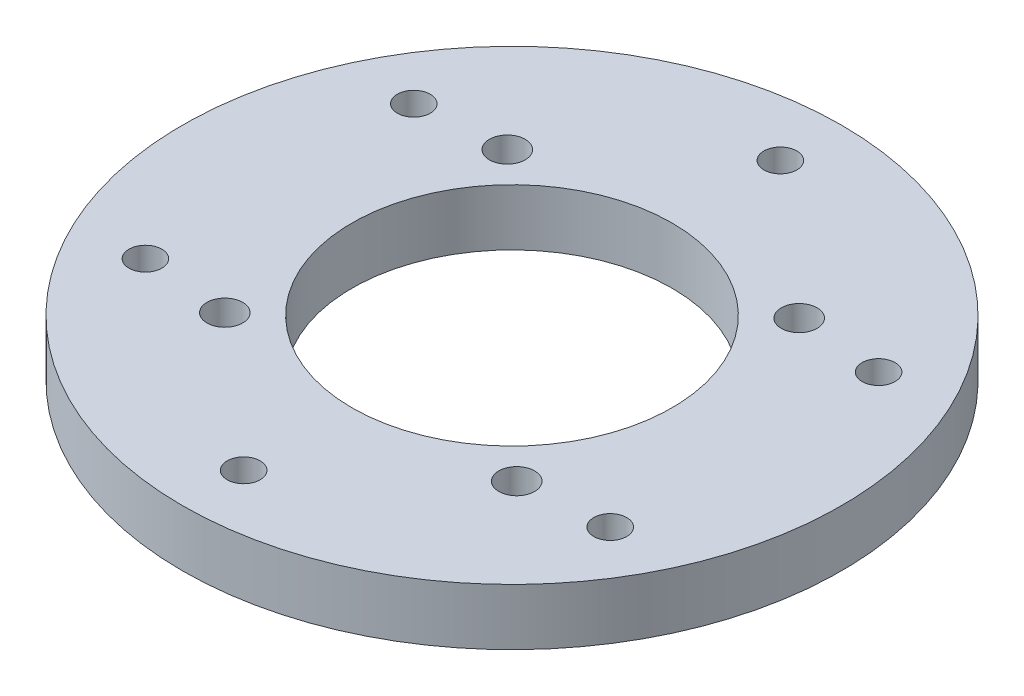
from build123d import *

# Parameters (mm, degrees)
SKETCH_1_R               = 35
EXTRUDE_1_DEPTH          = 6
HOLE_WIZARD_1_D          = 3.5
PATTERN_CIRCULAR_1_COUNT = 6
HOLE_WIZARD_2_D          = 3.8
SKETCH_8_R               = 11
CUT_EXTRUDE_1_DEPTH      = 10
HOLE_WIZARD_3_D          = 7
HOLE_WIZARD_3_DEPTH      = 1.5
SKETCH_13_R              = 17
CUT_EXTRUDE_2_DEPTH      = 10


with BuildPart() as part:
    # 草图1 → 凸台-拉伸1 (new body)
    with BuildSketch(Plane(origin=(0, 0, 0), x_dir=(1, 0, 0), z_dir=(0, 1, 0))):
        with Locations(Location((0, 0, 0), (0, 0, 270))):
            Circle(SKETCH_1_R)
    extrude(amount=EXTRUDE_1_DEPTH)

    # 孔1 (through all)
    with Locations(Plane(origin=(0, 6, 0), x_dir=(1, 0, 0), z_dir=(0, 1, 0))):
        with Locations((0, 28.5)):
            hole_wizard_1 = Hole(HOLE_WIZARD_1_D / 2)

    # 阵列(圆周)1: 孔1 ×6 about axis
    pattern_circular_1_axis = Axis((0, 0, 0), (0, 1, 0))
    for i in range(1, PATTERN_CIRCULAR_1_COUNT):
        add(hole_wizard_1.rotate(pattern_circular_1_axis, i * 360 / PATTERN_CIRCULAR_1_COUNT), mode=Mode.SUBTRACT)

    # 孔2 (through all)
    with Locations(Plane(origin=(0, 6, 0), x_dir=(1, 0, 0), z_dir=(0, 1, 0))):
        with Locations((-15.5, 15), (15.5, 15), (15.5, -15), (-15.5, -15)):
            Hole(HOLE_WIZARD_2_D / 2)

    # 草图8 → 切除-拉伸1 (cut)
    with BuildSketch(Plane(origin=(0, 6, 0), x_dir=(1, 0, 0), z_dir=(0, 1, 0))):
        with Locations(Location((0, 0, 0), (0, 0, 270))):
            Circle(SKETCH_8_R)
    extrude(amount=-CUT_EXTRUDE_1_DEPTH, mode=Mode.SUBTRACT)

    # 孔3
    with Locations(Plane(origin=(0, 0, 0), x_dir=(-1, 0, 0), z_dir=(0, -1, 0))):
        with Locations((-15.5, 15), (15.5, 15), (15.5, -15), (-15.5, -15)):
            Hole(HOLE_WIZARD_3_D / 2, depth=HOLE_WIZARD_3_DEPTH)

    # 草图13 → 切除-拉伸2 (cut)
    with BuildSketch(Plane.XZ):
        with Locations(Location((0, 0, 0), (0, 0, 270))):
            Circle(SKETCH_13_R)
    extrude(amount=-CUT_EXTRUDE_2_DEPTH, mode=Mode.SUBTRACT)


solid = part.part
